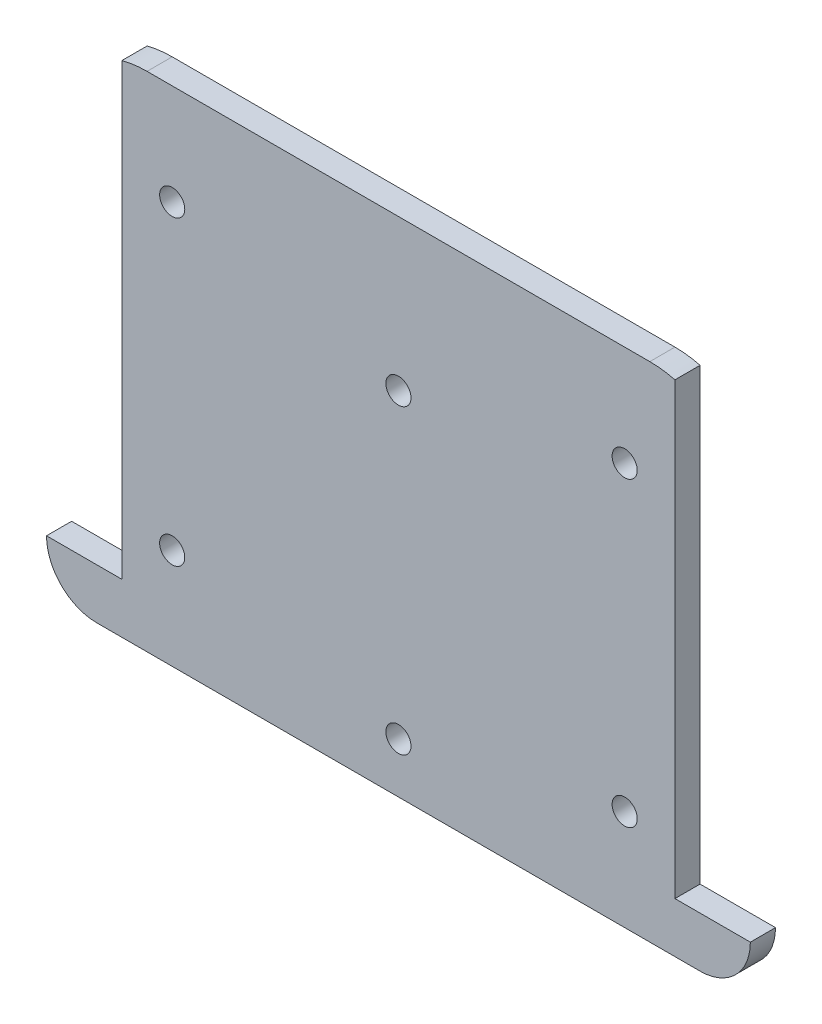
from build123d import *

# Parameters (mm, degrees)
BOSS_EXTRUDE1_DEPTH = 5
SKETCH2_R           = 2.5
CUT_EXTRUDE1_DEPTH  = 5
SKETCH3_W           = 15
SKETCH3_H           = 89.364916731
CUT_EXTRUDE2_DEPTH  = 5
SKETCH4_R           = 2.5
CUT_EXTRUDE3_DEPTH  = 5


with BuildPart() as part:
    # Sketch1 → Boss-Extrude1 (new body)
    with BuildSketch(Plane.XY):
        with BuildLine():
            Line((-60, -50), (60, -50))
            ThreePointArc((60, -50), (67.071067812, -47.071067812), (70, -40))
            Line((70, -40), (70, 30))
            ThreePointArc((70, 30), (64.142135624, 44.142135624), (50, 50))
            Line((50, 50), (-50, 50))
            ThreePointArc((-50, 50), (-64.142135624, 44.142135624), (-70, 30))
            Line((-70, 30), (-70, -40))
            ThreePointArc((-70, -40), (-67.071067812, -47.071067812), (-60, -50))
        make_face()
    extrude(amount=BOSS_EXTRUDE1_DEPTH)

    # Sketch2 → Cut-Extrude1 (cut)
    with BuildSketch(Plane.XY.offset(5)):
        with Locations((0, -40)):
            Circle(SKETCH2_R)
        with Locations((-45, 30)):
            Circle(SKETCH2_R)
        with Locations(Location((45, 30, 0), (0, 0, 180))):
            Circle(SKETCH2_R)
        with Locations(Location((-45, -30, 0), (0, 0, 180))):
            Circle(SKETCH2_R)
        with Locations((45, -30)):
            Circle(SKETCH2_R)
    extrude(amount=-CUT_EXTRUDE1_DEPTH, mode=Mode.SUBTRACT)

    # Sketch3 → Cut-Extrude2 (cut)
    with BuildSketch(Plane.XY.offset(5)):
        with Locations((62.5, 4.682458366)):
            Rectangle(SKETCH3_W, SKETCH3_H)
        with Locations((-62.5, 4.682458366)):
            Rectangle(SKETCH3_W, SKETCH3_H)
    extrude(amount=-CUT_EXTRUDE2_DEPTH, mode=Mode.SUBTRACT)

    # Sketch4 → Cut-Extrude3 (cut)
    with BuildSketch(Plane.XY.offset(5)):
        with Locations((0, 20)):
            Circle(SKETCH4_R)
    extrude(amount=-CUT_EXTRUDE3_DEPTH, mode=Mode.SUBTRACT)


solid = part.part
